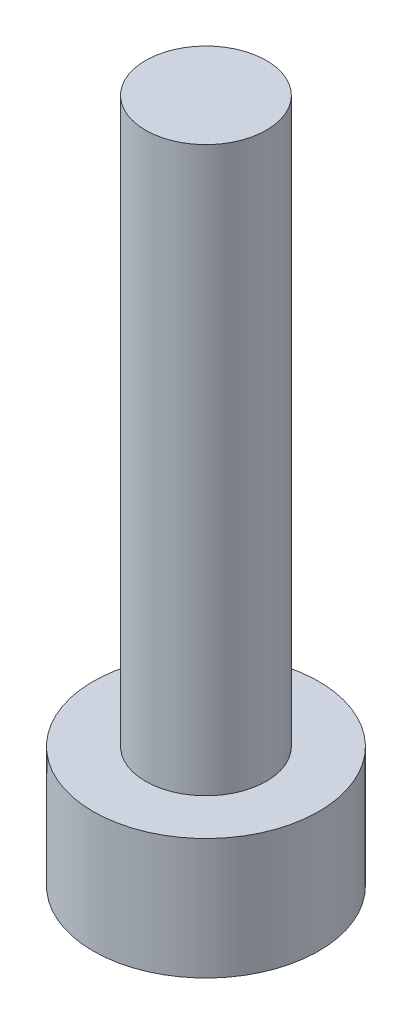
from build123d import *

# Parameters (mm, degrees)
SKETCH_1_R      = 2.8
EXTRUDE_1_DEPTH = 3
SKETCH_2_R      = 1.5
EXTRUDE_2_DEPTH = 14


with BuildPart() as part:
    # 草图1 → 凸台-拉伸1 (new body)
    with BuildSketch(Plane(origin=(0, 0, 0), x_dir=(1, 0, 0), z_dir=(0, 1, 0))):
        with Locations(Location((0, 0, 0), (0, 0, 270))):
            Circle(SKETCH_1_R)
    extrude(amount=EXTRUDE_1_DEPTH)

    # 草图2 → 凸台-拉伸2 (add)
    with BuildSketch(Plane(origin=(0, 3, 0), x_dir=(1, 0, 0), z_dir=(0, 1, 0))):
        with Locations(Location((0, 0, 0), (0, 0, 270))):
            Circle(SKETCH_2_R)
    extrude(amount=EXTRUDE_2_DEPTH)


solid = part.part
